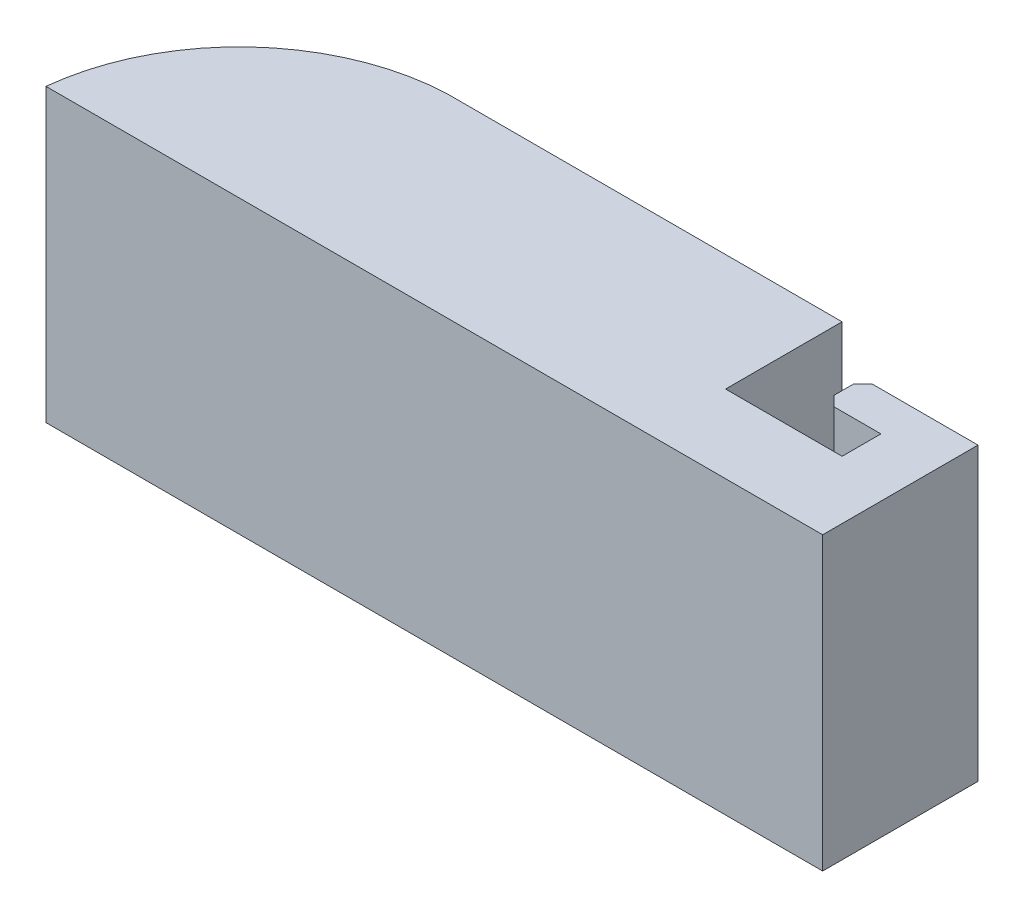
from build123d import *

# Parameters (mm, degrees)
SKETCH1_W           = 40
SKETCH1_H           = 10
BOSS_EXTRUDE1_DEPTH = 15
CUT_EXTRUDE1_DEPTH  = 44.874821937
CUT_EXTRUDE2_DEPTH  = 44.874821937
CHAMFER1_SIZE       = 0.5


with BuildPart() as part:
    # Sketch1 → Boss-Extrude1 (new body)
    with BuildSketch(Plane(origin=(0, 0, 0), x_dir=(1, 0, 0), z_dir=(0, 1, 0))):
        with Locations((20, 5)):
            Rectangle(SKETCH1_W, SKETCH1_H)
    extrude(amount=BOSS_EXTRUDE1_DEPTH)

    # Sketch2 → Cut-Extrude1 (cut, through all)
    with BuildSketch(Plane(origin=(0, 15, 0), x_dir=(1, 0, 0), z_dir=(0, 1, 0))):
        with BuildLine():
            Line((10.663840824, 10), (0, 10))
            Line((0, 10), (0, 0))
            ThreePointArc((0, 0), (3.469314238, 6.986253576), (10.663840824, 10))
        make_face()
    extrude(amount=-CUT_EXTRUDE1_DEPTH, mode=Mode.SUBTRACT)

    # Sketch3 → Cut-Extrude2 (cut, through all)
    with BuildSketch(Plane(origin=(0, 15, 0), x_dir=(1, 0, 0), z_dir=(0, 1, 0))):
        Polygon((40, 10), (31, 10), (31, 4), (37, 4), (37, 6), (34.071499669, 6), (34.071499669, 8), (40, 8), align=None)
    extrude(amount=-CUT_EXTRUDE2_DEPTH, mode=Mode.SUBTRACT)

    # Chamfer1
    chamfer1_edges = [part.edges().sort_by_distance(p)[0] for p in [
        (34.071499669, 7.5, -8),
        (34.071499669, 7.5, -6),
    ]]
    chamfer(chamfer1_edges, length=CHAMFER1_SIZE)


solid = part.part
